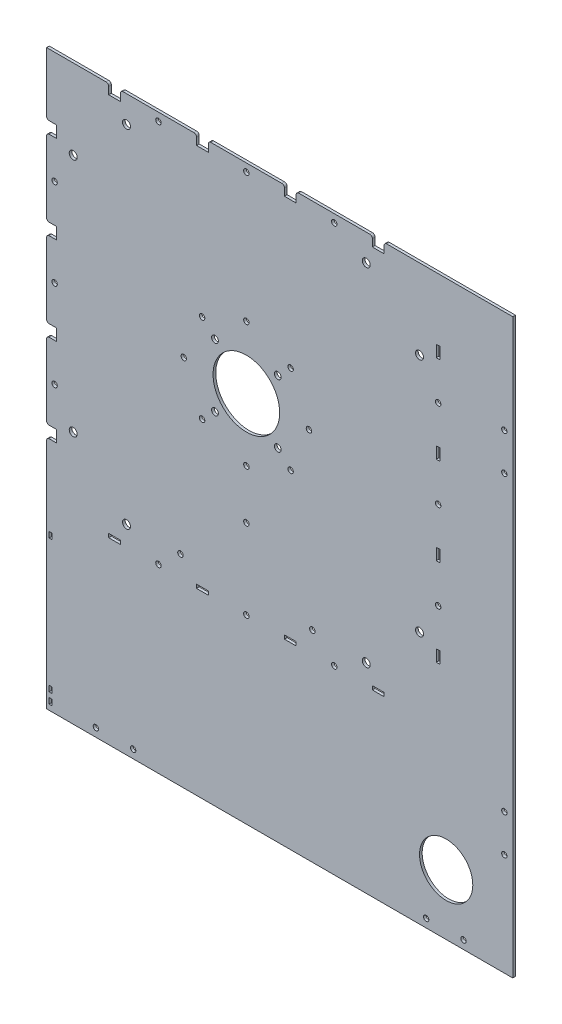
from build123d import *

# Parameters (mm, degrees)
SKETCH_1_R          = 25
SKETCH_1_R_2        = 2.55
EXTRUDE_1_DEPTH     = 2
SKETCH_3_R          = 2.05
SKETCH_3_W          = 8.8
SKETCH_3_H          = 2.8
SKETCH_3_W_2        = 2.8
SKETCH_3_H_2        = 8.8
CUT_EXTRUDE_2_DEPTH = 4
SKETCH_7_R          = 3
CUT_EXTRUDE_3_DEPTH = 10
SKETCH_9_R          = 20
SKETCH_9_R_2        = 2
SKETCH_9_W          = 2.3
SKETCH_9_H          = 4.3
EXTRUDE_3_DEPTH     = 2
SKETCH_10_W         = 7.415917821
SKETCH_10_H         = 8.8
SKETCH_10_W_2       = 11.642627239
SKETCH_10_W_3       = 9.503104614
SKETCH_10_W_4       = 8.8
SKETCH_10_H_2       = 9.953693287
SKETCH_10_H_3       = 6.236527311
SKETCH_10_H_4       = 11.786151392
SKETCH_10_H_5       = 12.789851521
CUT_EXTRUDE_4_DEPTH = 2
FILLET_1_R          = 2


with BuildPart() as part:
    # 草图1 → 凸台-拉伸1 (new body)
    with BuildSketch(Plane.XY):
        Polygon((151.457142857, -41.187142857), (151.457142857, 108.812857143), (-148.542857143, 108.812857143), (-148.542857143, -191.187142857), (151.457142857, -191.187142857), align=None)
        with Locations((1.457142857, -41.187142857)):
            Circle(SKETCH_1_R, mode=Mode.SUBTRACT)
        with Locations((25.027142857, -17.617142857)):
            Circle(SKETCH_1_R_2, mode=Mode.SUBTRACT)
        with Locations((25.027142857, -64.757142857)):
            Circle(SKETCH_1_R_2, mode=Mode.SUBTRACT)
        with Locations((-22.112857143, -64.757142857)):
            Circle(SKETCH_1_R_2, mode=Mode.SUBTRACT)
        with Locations((-22.112857143, -17.617142857)):
            Circle(SKETCH_1_R_2, mode=Mode.SUBTRACT)
    extrude(amount=EXTRUDE_1_DEPTH)

    # 草图3 → 切除-拉伸2 (cut)
    with BuildSketch(Plane.XY.offset(2)):
        with Locations((1.457142857, -185.187142857)):
            Circle(SKETCH_3_R)
        with Locations((67.457142857, -185.187142857)):
            Circle(SKETCH_3_R)
        with Locations((-64.542857143, -185.187142857)):
            Circle(SKETCH_3_R)
        with Locations((-142.542857143, 24.812857143)):
            Circle(SKETCH_3_R)
        with Locations((-142.542857143, -41.187142857)):
            Circle(SKETCH_3_R)
        with Locations((-142.542857143, -107.187142857)):
            Circle(SKETCH_3_R)
        with Locations((67.457142857, 102.812857143)):
            Circle(SKETCH_3_R)
        with Locations((1.457142857, 102.812857143)):
            Circle(SKETCH_3_R)
        with Locations((-64.542857143, 102.812857143)):
            Circle(SKETCH_3_R)
        with Locations((145.457142857, -107.187142857)):
            Circle(SKETCH_3_R)
        with Locations((145.457142857, -41.187142857)):
            Circle(SKETCH_3_R)
        with Locations((145.457142857, 24.812857143)):
            Circle(SKETCH_3_R)
        with Locations((50.957142857, -170.187142857)):
            Circle(SKETCH_3_R)
        with Locations((-48.042857143, -170.187142857)):
            Circle(SKETCH_3_R)
        with Locations((1.457142857, -88.187142857)):
            Circle(SKETCH_3_R)
        with Locations((-31.776875859, -74.421161573)):
            Circle(SKETCH_3_R)
        with Locations((-45.542857143, -41.187142857)):
            Circle(SKETCH_3_R)
        with Locations((-31.776875859, -7.953124141)):
            Circle(SKETCH_3_R)
        with Locations((1.457142857, 5.812857143)):
            Circle(SKETCH_3_R)
        with Locations((34.691161573, -7.953124141)):
            Circle(SKETCH_3_R)
        with Locations((48.457142857, -41.187142857)):
            Circle(SKETCH_3_R)
        with Locations((34.691161573, -74.421161573)):
            Circle(SKETCH_3_R)
        with Locations((1.457142857, -125.187142857)):
            Circle(SKETCH_3_R)
        with Locations((100.457142857, -185.187142857)):
            Rectangle(SKETCH_3_W, SKETCH_3_H)
        with Locations((34.457142857, -185.187142857)):
            Rectangle(SKETCH_3_W, SKETCH_3_H)
        with Locations((-31.542857143, -185.187142857)):
            Rectangle(SKETCH_3_W, SKETCH_3_H)
        with Locations((-97.542857143, -185.187142857)):
            Rectangle(SKETCH_3_W, SKETCH_3_H)
        with Locations((-142.542857143, 57.812857143)):
            Rectangle(SKETCH_3_W_2, SKETCH_3_H_2)
        with Locations((-142.542857143, -8.187142857)):
            Rectangle(SKETCH_3_W_2, SKETCH_3_H_2)
        with Locations((-142.542857143, -74.187142857)):
            Rectangle(SKETCH_3_W_2, SKETCH_3_H_2)
        with Locations((-142.542857143, -140.187142857)):
            Rectangle(SKETCH_3_W_2, SKETCH_3_H_2)
        with Locations((100.457142857, 102.812857143)):
            Rectangle(SKETCH_3_W, SKETCH_3_H)
        with Locations((34.457142857, 102.812857143)):
            Rectangle(SKETCH_3_W, SKETCH_3_H)
        with Locations((-31.542857143, 102.812857143)):
            Rectangle(SKETCH_3_W, SKETCH_3_H)
        with Locations((-97.542857143, 102.812857143)):
            Rectangle(SKETCH_3_W, SKETCH_3_H)
        with Locations((145.457142857, -140.187142857)):
            Rectangle(SKETCH_3_W_2, SKETCH_3_H_2)
        with Locations((145.457142857, -74.187142857)):
            Rectangle(SKETCH_3_W_2, SKETCH_3_H_2)
        with Locations((145.457142857, -8.187142857)):
            Rectangle(SKETCH_3_W_2, SKETCH_3_H_2)
        with Locations((145.457142857, 57.812857143)):
            Rectangle(SKETCH_3_W_2, SKETCH_3_H_2)
    extrude(amount=-CUT_EXTRUDE_2_DEPTH, mode=Mode.SUBTRACT)

    # 草图7 → 切除-拉伸3 (cut)
    with BuildSketch(Plane.XY.offset(2)):
        with Locations((-88.542857143, -171.187142857)):
            Circle(SKETCH_7_R)
        with Locations((91.457142857, -171.187142857)):
            Circle(SKETCH_7_R)
        with Locations((-128.542857143, 48.812857143)):
            Circle(SKETCH_7_R)
        with Locations((-128.542857143, -131.187142857)):
            Circle(SKETCH_7_R)
        with Locations((91.457142857, 88.812857143)):
            Circle(SKETCH_7_R)
        with Locations((-88.542857143, 88.812857143)):
            Circle(SKETCH_7_R)
        with Locations((131.457142857, -131.187142857)):
            Circle(SKETCH_7_R)
        with Locations((131.457142857, 48.812857143)):
            Circle(SKETCH_7_R)
    extrude(amount=-CUT_EXTRUDE_3_DEPTH, mode=Mode.SUBTRACT)

    # 草图9 → 凸台-拉伸3 (add)
    with BuildSketch(Plane.XY.offset(2)):
        Polygon((151.457142857, 108.812857143), (201.457142857, 108.812857143), (201.457142857, -191.187142857), (201.457142857, -321.187142857), (-148.542857143, -321.187142857), (-148.542857143, -191.187142857), (151.457142857, -191.187142857), align=None)
        with Locations((151.457142857, -275.799903925)):
            Circle(SKETCH_9_R, mode=Mode.SUBTRACT)
        with Locations((-111.542857143, -314.887142857)):
            Circle(SKETCH_9_R_2, mode=Mode.SUBTRACT)
        with Locations((-83.542857143, -314.887142857)):
            Circle(SKETCH_9_R_2, mode=Mode.SUBTRACT)
        with Locations(Location((136.457142857, -314.887142857, 0), (0, 0, 180))):
            Circle(SKETCH_9_R_2, mode=Mode.SUBTRACT)
        with Locations(Location((164.457142857, -314.887142857, 0), (0, 0, 180))):
            Circle(SKETCH_9_R_2, mode=Mode.SUBTRACT)
        with Locations((195.157142857, -244.187142857)):
            Circle(SKETCH_9_R_2, mode=Mode.SUBTRACT)
        with Locations((195.157142857, -216.187142857)):
            Circle(SKETCH_9_R_2, mode=Mode.SUBTRACT)
        with Locations(Location((195.157142857, 3.812857143, 0), (0, 0, 180))):
            Circle(SKETCH_9_R_2, mode=Mode.SUBTRACT)
        with Locations(Location((195.157142857, 31.812857143, 0), (0, 0, 180))):
            Circle(SKETCH_9_R_2, mode=Mode.SUBTRACT)
        with Locations((-145.592857143, -315.037142857)):
            Rectangle(SKETCH_9_W, SKETCH_9_H, mode=Mode.SUBTRACT)
        with Locations((-145.592857143, -307.037142857)):
            Rectangle(SKETCH_9_W, SKETCH_9_H, mode=Mode.SUBTRACT)
        with Locations((-145.592857143, -207.037142857)):
            Rectangle(SKETCH_9_W, SKETCH_9_H, mode=Mode.SUBTRACT)
    extrude(amount=-EXTRUDE_3_DEPTH)

    # 草图10 → 切除-拉伸4 (cut)
    with BuildSketch(Plane.XY.offset(2)):
        with Locations((-147.650816054, 57.812857143)):
            Rectangle(SKETCH_10_W, SKETCH_10_H)
        with Locations((-149.764170762, -8.187142857)):
            Rectangle(SKETCH_10_W_2, SKETCH_10_H)
        with Locations((-148.69440945, -74.187142857)):
            Rectangle(SKETCH_10_W_3, SKETCH_10_H)
        with Locations((-149.764170762, -140.187142857)):
            Rectangle(SKETCH_10_W_2, SKETCH_10_H)
        with Locations((-97.542857143, 109.189703787)):
            Rectangle(SKETCH_10_W_4, SKETCH_10_H_2)
        with Locations((-31.542857143, 107.331120799)):
            Rectangle(SKETCH_10_W_4, SKETCH_10_H_3)
        with Locations((34.457142857, 110.105932839)):
            Rectangle(SKETCH_10_W_4, SKETCH_10_H_4)
        with Locations((100.457142857, 110.607782904)):
            Rectangle(SKETCH_10_W_4, SKETCH_10_H_5)
    extrude(amount=-CUT_EXTRUDE_4_DEPTH, mode=Mode.SUBTRACT)

    # 圆角1
    fillet_1_edges = [part.edges().sort_by_distance(p)[0] for p in [
        (96.057142857, 108.812857143, 1),
        (104.857142857, 108.812857143, 1),
        (30.057142857, 108.812857143, 1),
        (38.857142857, 108.812857143, 1),
        (-35.942857143, 108.812857143, 1),
        (-27.142857143, 108.812857143, 1),
        (-148.542857143, -12.587142857, 1),
        (-148.542857143, -3.787142857, 1),
        (-148.542857143, -78.587142857, 1),
        (-148.542857143, -69.787142857, 1),
        (-148.542857143, -144.587142857, 1),
        (-148.542857143, -135.787142857, 1),
        (-101.942857143, 108.812857143, 1),
        (-93.142857143, 108.812857143, 1),
        (-148.542857143, 53.412857143, 1),
        (-148.542857143, 62.212857143, 1),
    ]]
    fillet(fillet_1_edges, radius=FILLET_1_R)


solid = part.part
